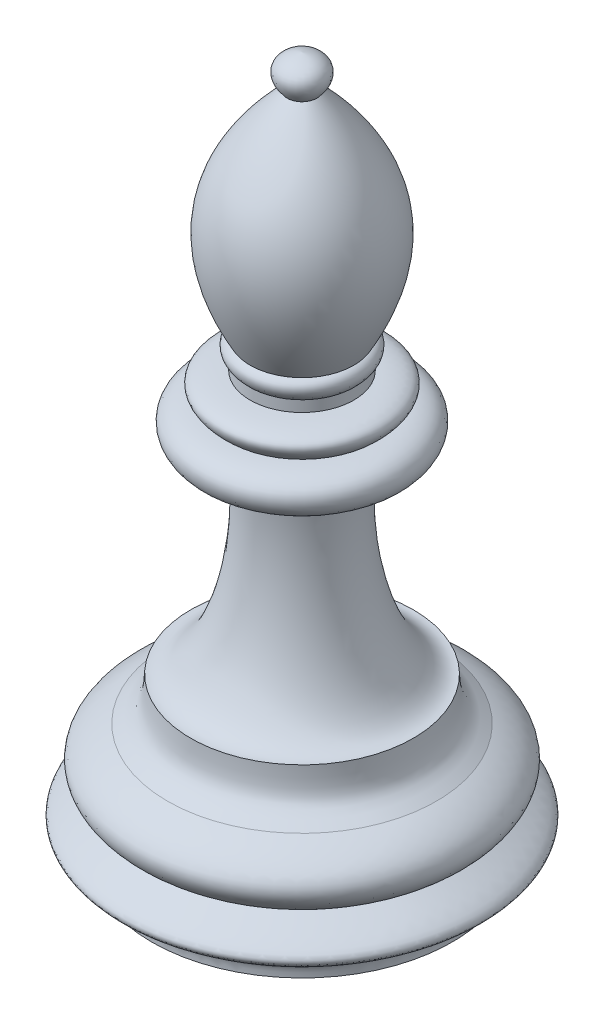
from build123d import *

# Parameters (mm, degrees)
SCALE1_SCALE = 0.5


with BuildPart() as part:
    # Sketch1 → Revolve1 (revolve)
    with BuildSketch(Plane.XY, mode=Mode.PRIVATE) as revolve1_sk:
        with BuildLine():
            Line((0, 0), (141.048383614, 0))
            add(Edge.make_bspline(
                [(141.048383614, 0), (140.949126619, 13.527914519), (142.54013241, 11.519741138), (158.206953499, 21.771565153)],
                knots=[0, 0, 0, 0, 1, 1, 1, 1], degree=3))
            add(Edge.make_bspline(
                [(158.206953499, 21.771565153), (180.316059438, 34.006813578), (168.869872315, 38.023146808), (139.142614218, 54.271724498)],
                knots=[0, 0, 0, 0, 1, 1, 1, 1], degree=3))
            add(Edge.make_bspline(
                [(139.142614218, 54.271724498), (181.609483302, 83.23222304), (126.219243593, 107.046173191)],
                knots=[0, 0, 0, 1, 1, 1], degree=2))
            add(Edge.make_bspline(
                [(126.219243593, 107.046173191), (109.040272384, 118.200248576), (105.666874286, 117.279550385), (104.45384876, 147.281715063)],
                knots=[0, 0, 0, 0, 1, 1, 1, 1], degree=3))
            add(Edge.make_bspline(
                [(104.45384876, 147.281715063), (67.813194478, 144.574050392), (36.870401404, 252.878806414), (51.615739464, 334.146266409)],
                knots=[0, 0, 0, 0, 1, 1, 1, 1], degree=3))
            add(Edge.make_bspline(
                [(51.615739464, 334.146266409), (67.604544069, 334.581032365), (79.463066726, 334.809642267), (98.838257313, 340.678887261), (105.189390965, 369.595859462), (68.796581204, 370.316459545)],
                knots=[0, 0, 0, 0, 0.251529733, 0.351529733, 1, 1, 1, 1], degree=3))
            add(Edge.make_bspline(
                [(68.796581204, 370.316459545), (83.640693367, 383.420132687), (82.485128513, 393.37116616), (48.69490146, 394.128560251)],
                knots=[0, 0, 0, 0, 1, 1, 1, 1], degree=3))
            Line((48.69490146, 394.128560251), (48.69490146, 404.474526267))
            add(Edge.make_bspline(
                [(48.69490146, 404.474526267), (56.092921427, 410.838363271), (56.519316297, 419.343233223), (48.69490146, 422.452762295)],
                knots=[0, 0, 0, 0, 1, 1, 1, 1], degree=3))
            add(Edge.make_bspline(
                [(48.69490146, 422.452762295), (94.872662122, 505.493073348), (73.84444889, 562.27469651), (13.803783918, 621.941598217)],
                knots=[0, 0, 0, 0, 1, 1, 1, 1], degree=3))
            add(Edge.make_bspline(
                [(13.803783918, 621.941598217), (27.20257307, 636.693800415), (20.637873115, 649.241336914), (0, 652.416572309)],
                knots=[0, 0, 0, 0, 1, 1, 1, 1], degree=3))
            Line((0, 652.416572309), (0, 0))
        make_face()
    revolve(revolve1_sk.sketch.rotate(Axis((0, -39.305749446, 0), (0, 1, 0)), 90), axis=Axis((0, -39.305749446, 0), (0, 1, 0)))


with BuildPart() as part_1:
    # Scale1: scaled about (0, 0, 0)
    add(part.part.scale(SCALE1_SCALE))


solid = part_1.part
